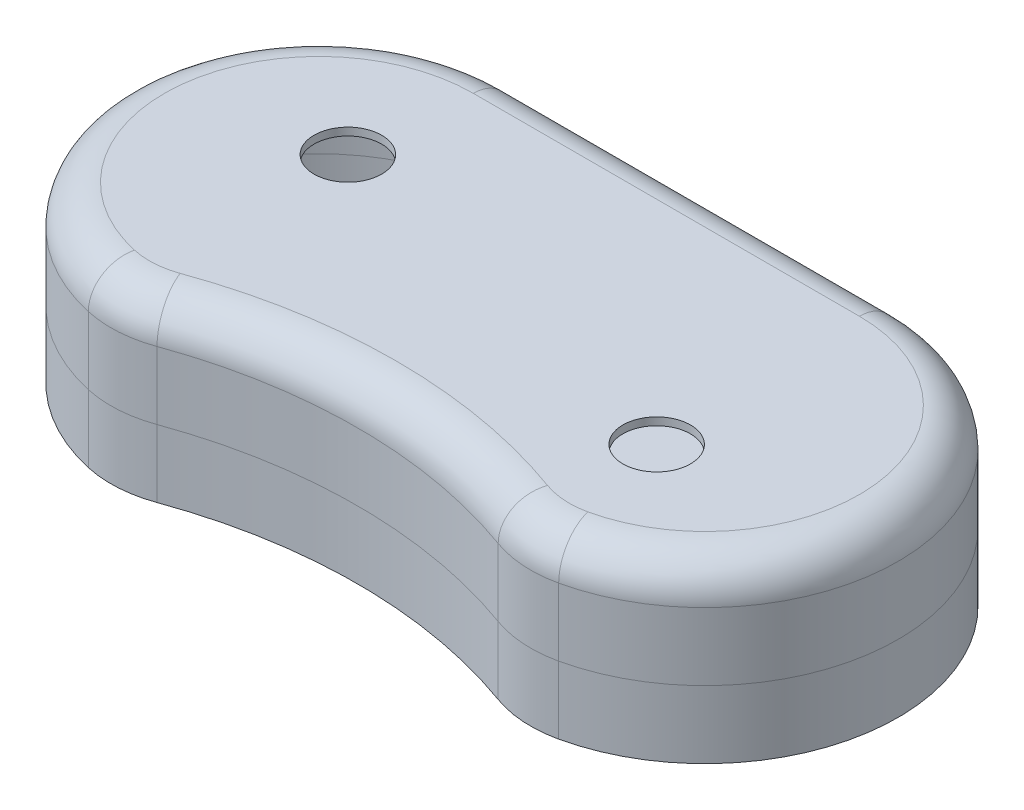
from build123d import *

# Parameters (mm, degrees)
BOSS_EXTRUDE1_DEPTH    = 45
FILLET2_R              = 30
FILLET4_R              = 10
SHELL1_T               = 2
CUT_EXTRUDE1_REACH     = 145.605
SKETCH10_R             = 8.75
SKETCH12_R             = 7.5
BOSS_EXTRUDE2_DEPTH    = 25.7
BOSS_EXTRUDE5_START    = -17.5
SKETCH29_R             = 7.5
BOSS_EXTRUDE5_DEPTH    = 17.5
CUT_EXTRUDE4_REACH     = 167.994
SKETCH13_W             = 12
SKETCH13_H             = 10
FILLET7_R              = 2
SPLIT1_SURFACE_1_BACK  = 228.879
SPLIT1_SURFACE_1_DEPTH = 457.758
SPLIT1_SURFACE_2_BACK  = 228.879
SPLIT1_SURFACE_2_DEPTH = 457.758


with BuildPart() as part:
    # Sketch7 → Boss-Extrude1 (new body)
    with BuildSketch(Plane(origin=(0, 0, 0), x_dir=(1, 0, 0), z_dir=(0, 1, 0))):
        with BuildLine():
            Line((-25, -45), (-25, 45))
            Line((-25, 45), (25, 45))
            ThreePointArc((25, 45), (75, -5), (25, -55))
            ThreePointArc((25, -55), (0.495097568, -47.52451216), (-25, -45))
        make_face()
    extrude(amount=BOSS_EXTRUDE1_DEPTH)

    # Fillet2
    fillet2_edges = [part.edges().sort_by_distance(p)[0] for p in [
        (25, 22.5, 55),
    ]]
    fillet(fillet2_edges, radius=FILLET2_R)

    # Mirror1: part across plane


with BuildPart() as part_1:
    add(part.part)
    add(part.part.mirror(Plane(origin=(-25, 45, 45), x_dir=(0, 0, 1), z_dir=(-1, 0, 0))))

    # Fillet4
    fillet4_edges = [part_1.edges().sort_by_distance(p)[0] for p in [
        (-25, 45, 45),
        (74.6980897, 45, -0.486335772),
        (-25, 45, -45),
        (27.462260721, 45, 54.458155387),
        (-124.6980897, 45, -0.486335772),
        (-77.462260721, 45, 54.458155387),
    ]]
    fillet(fillet4_edges, radius=FILLET4_R)

    # Shell1 (no face opened: a closed hollow body)
    add(offset(amount=-SHELL1_T, mode=Mode.PRIVATE), mode=Mode.SUBTRACT)

    # Sketch10 → Cut-Extrude1 (cut, up to next)
    with BuildSketch(Plane(origin=(0, 45, 0), x_dir=(1, 0, 0), z_dir=(0, 1, 0)), mode=Mode.PRIVATE) as cut_extrude1_sk1:
        with Locations(Location((-77.486999678, 5, 0), (0, 0, 270))):
            Circle(SKETCH10_R)
    cut_extrude1_tool1 = extrude(cut_extrude1_sk1.sketch, amount=-CUT_EXTRUDE1_REACH, mode=Mode.PRIVATE) & part_1.part
    # Sketch10 → Cut-Extrude1 (cut, up to next)
    with BuildSketch(Plane(origin=(0, 45, 0), x_dir=(1, 0, 0), z_dir=(0, 1, 0)), mode=Mode.PRIVATE) as cut_extrude1_sk2:
        with Locations(Location((27.486999678, -20, 0), (0, 0, 270))):
            Circle(SKETCH10_R)
    cut_extrude1_tool2 = extrude(cut_extrude1_sk2.sketch, amount=-CUT_EXTRUDE1_REACH, mode=Mode.PRIVATE) & part_1.part
    add(cut_extrude1_tool1.solids().sort_by_distance((-77.487, 45, -5))[0], mode=Mode.SUBTRACT)
    add(cut_extrude1_tool2.solids().sort_by_distance((27.487, 45, 20))[0], mode=Mode.SUBTRACT)

    # Sketch12 → Boss-Extrude2 (add)
    with BuildSketch(Plane(origin=(0, 45, 0), x_dir=(1, 0, 0), z_dir=(0, 1, 0))):
        with Locations(Location((-86.843377882, -32.820166375, 0), (0, 0, 270))):
            Circle(SKETCH12_R)
        with Locations(Location((33.876721378, 19.89503765, 0), (0, 0, 270))):
            Circle(SKETCH12_R)
    extrude(amount=-BOSS_EXTRUDE2_DEPTH)

    # Sketch29 → Boss-Extrude5 (add)
    with BuildSketch(Plane.XZ.offset(BOSS_EXTRUDE5_START)):
        with Locations(Location((-86.843377882, 32.820166375, 0), (0, 0, 90))):
            Circle(SKETCH29_R)
        with Locations(Location((33.876721378, -19.89503765, 0), (0, 0, 90))):
            Circle(SKETCH29_R)
    extrude(amount=BOSS_EXTRUDE5_DEPTH)

    # Sketch13 → Cut-Extrude4 (cut, up to next)
    with BuildSketch(Plane(origin=(0, 0, -45), x_dir=(-1, 0, 0), z_dir=(0, 0, -1)), mode=Mode.PRIVATE) as cut_extrude4_sk1:
        with Locations((25, 17.5)):
            Rectangle(SKETCH13_W, SKETCH13_H)
    cut_extrude4_tool1 = extrude(cut_extrude4_sk1.sketch, amount=-CUT_EXTRUDE4_REACH, mode=Mode.PRIVATE) & part_1.part
    add(cut_extrude4_tool1.solids().sort_by_distance((-25, 17.5, -45))[0], mode=Mode.SUBTRACT)

    # Fillet7
    fillet7_edges = [part_1.edges().sort_by_distance(p)[0] for p in [
        (-19, 22.5, -44),
        (-31, 22.5, -44),
        (-31, 12.5, -44),
        (-19, 12.5, -44),
    ]]
    fillet(fillet7_edges, radius=FILLET7_R)


with BuildPart() as body_2:
    # Split1: the piece behind the surface
    add(part_1.part)
    # Split1 surface: a surface, the sketch's curves swept straight by 457.758 mm
    with BuildLine(Plane(origin=(0, 0, -45), x_dir=(-1, 0, 0), z_dir=(0, 0, -1)).offset(-SPLIT1_SURFACE_1_BACK), mode=Mode.PRIVATE) as split1_surface_1_path:
        Line((-94.910977175, 17.5), (148.554340896, 17.5))
    split1_surface_1 = Shell.extrude(split1_surface_1_path.wire(), (0 * SPLIT1_SURFACE_1_DEPTH, 0 * SPLIT1_SURFACE_1_DEPTH, -1 * SPLIT1_SURFACE_1_DEPTH))
    split(bisect_by=split1_surface_1, keep=Keep.BOTTOM)


with BuildPart() as part_2:
    add(part_1.part)

    # Split1: split by a surface, the side it looks to stays
    # Split1 surface: a surface, the sketch's curves swept straight by 457.758 mm
    with BuildLine(Plane(origin=(0, 0, -45), x_dir=(-1, 0, 0), z_dir=(0, 0, -1)).offset(-SPLIT1_SURFACE_2_BACK), mode=Mode.PRIVATE) as split1_surface_2_path:
        Line((-94.910977175, 17.5), (148.554340896, 17.5))
    split1_surface_2 = Shell.extrude(split1_surface_2_path.wire(), (0 * SPLIT1_SURFACE_2_DEPTH, 0 * SPLIT1_SURFACE_2_DEPTH, -1 * SPLIT1_SURFACE_2_DEPTH))
    split(bisect_by=split1_surface_2, keep=Keep.TOP)


solid = Compound([body_2.part, part_2.part])
